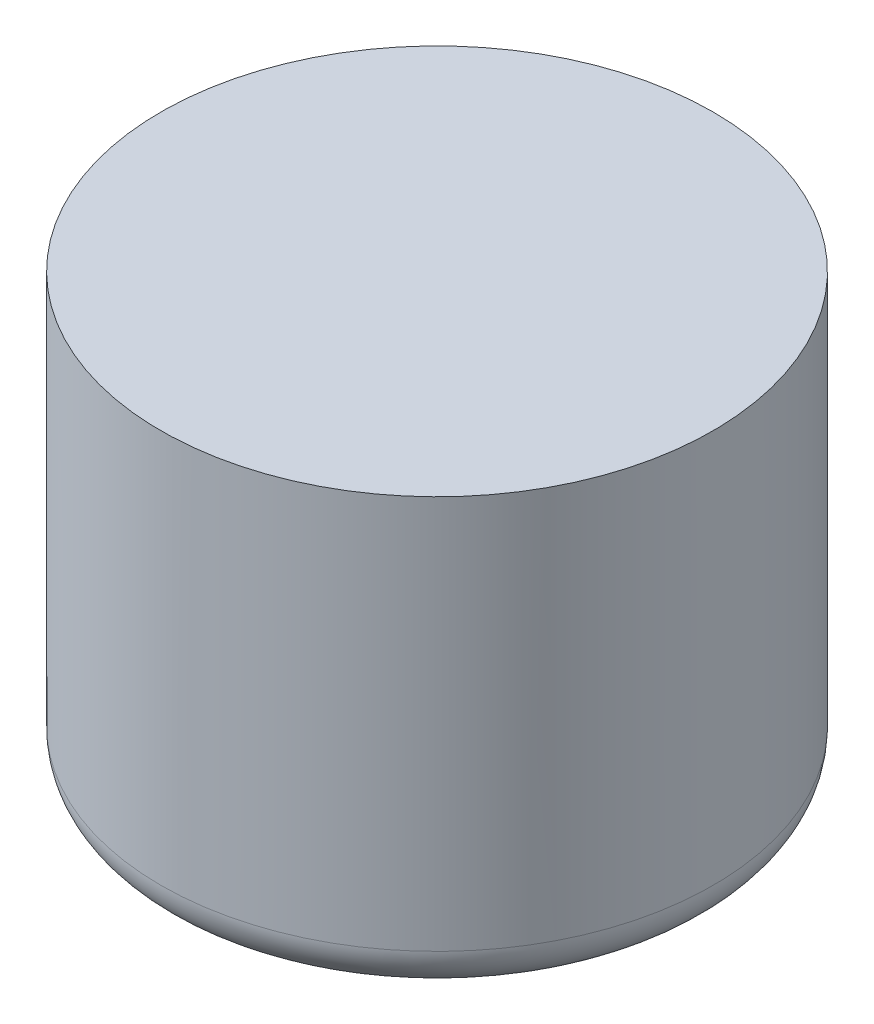
from build123d import *

# Parameters (mm, degrees)
SKETCH1_R           = 31.499937
BOSS_EXTRUDE1_DEPTH = 49.9999
FILLET1_R           = 5.08


with BuildPart() as part:
    # Sketch1 → Boss-Extrude1 (new body)
    with BuildSketch(Plane(origin=(0, 0, 0), x_dir=(1, 0, 0), z_dir=(0, 1, 0))):
        with Locations(Location((0, 0, 0), (0, 0, 90))):
            Circle(SKETCH1_R)
    extrude(amount=BOSS_EXTRUDE1_DEPTH)

    # Fillet1
    fillet1_edges = [part.edges().sort_by_distance(p)[0] for p in [
        (0, 0, 31.499937),
    ]]
    fillet(fillet1_edges, radius=FILLET1_R)


solid = part.part
